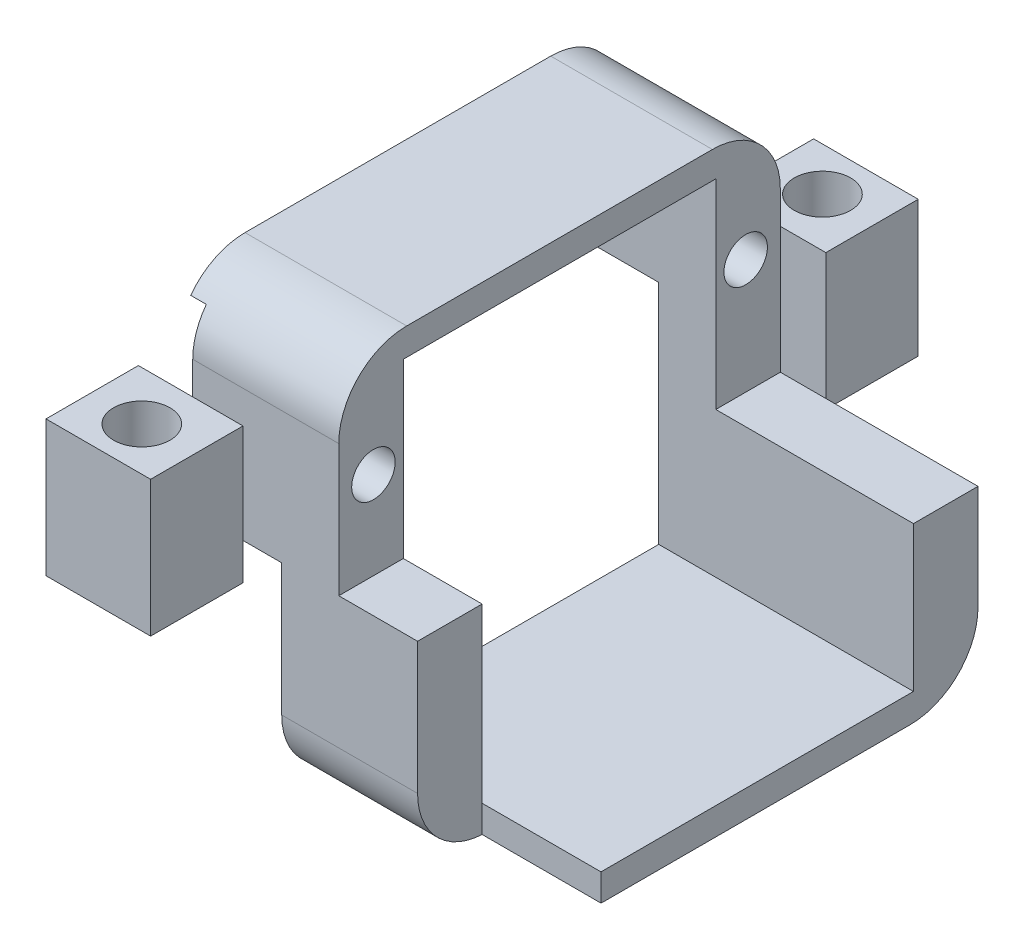
from build123d import *

# Parameters (mm, degrees)
BOSS_EXTRUDE1_DEPTH = 2
SKETCH1_3_W         = 10
SKETCH1_3_H         = 4.75
BOSS_EXTRUDE2_DEPTH = 12.7
BOSS_EXTRUDE3_START = 12.7
SKETCH3_W           = 11.9
SKETCH3_H           = 4.75
SKETCH3_W_2         = 10.75
BOSS_EXTRUDE3_DEPTH = 12.7
BOSS_EXTRUDE4_START = 25.4
SKETCH3_3_W         = 11.9
SKETCH3_3_H         = 4.75
SKETCH3_3_W_2       = 10.75
SKETCH3_3_W_3       = 1.15
BOSS_EXTRUDE4_DEPTH = 2
CUT_EXTRUDE1_START  = -1.1
SKETCH2_R           = 1.6
CUT_EXTRUDE1_DEPTH  = 8
CUT_EXTRUDE2_START  = 3.1
SKETCH2_3_R         = 1.6
CUT_EXTRUDE2_DEPTH  = 8
BOSS_EXTRUDE5_START = 10
SKETCH1_4_R         = 2.075
BOSS_EXTRUDE5_DEPTH = 10
FILLET1_R           = 5
CUT_EXTRUDE3_START  = 12.7
SKETCH5_W           = 14.55
SKETCH5_H           = 4.75
CUT_EXTRUDE3_DEPTH  = 2
CUT_EXTRUDE4_START  = 12.7
SKETCH6_W           = 7.7
SKETCH6_H           = 4.75
CUT_EXTRUDE4_DEPTH  = 4


with BuildPart() as part:
    # Sketch1 → Boss-Extrude1 (new body)
    with BuildSketch(Plane(origin=(0, 0, 0), x_dir=(1, 0, 0), z_dir=(0, 1, 0))):
        Polygon((-1.1, 16.25), (-1.1, -16.25), (8.9, -16.25), (8.9, -11.5), (17.65, -11.5), (17.65, 16.25), align=None)
    extrude(amount=-BOSS_EXTRUDE1_DEPTH)

    # Sketch1<3> → Boss-Extrude2 (add)
    with BuildSketch(Plane(origin=(0, 0, 0), x_dir=(1, 0, 0), z_dir=(0, 1, 0))):
        Polygon((6.45, 16.25), (-1.1, 16.25), (-1.1, 11.5), (17.65, 11.5), (17.65, 16.25), align=None)
        with Locations((3.9, -13.875)):
            Rectangle(SKETCH1_3_W, SKETCH1_3_H)
    extrude(amount=BOSS_EXTRUDE2_DEPTH)

    # Sketch3 → Boss-Extrude3 (add)
    with BuildSketch(Plane(origin=(0, 0, 0), x_dir=(1, 0, 0), z_dir=(0, 1, 0)).offset(BOSS_EXTRUDE3_START)):
        with Locations((-2.85, 13.875)):
            Rectangle(SKETCH3_W, SKETCH3_H)
        with Locations((-2.275, -13.875)):
            Rectangle(SKETCH3_W_2, SKETCH3_H)
    extrude(amount=BOSS_EXTRUDE3_DEPTH)

    # Sketch3<3> → Boss-Extrude4 (add)
    with BuildSketch(Plane(origin=(0, 0, 0), x_dir=(1, 0, 0), z_dir=(0, 1, 0)).offset(BOSS_EXTRUDE4_START)):
        with Locations((-2.85, 13.875)):
            Rectangle(SKETCH3_3_W, SKETCH3_3_H)
        Polygon((3.1, -11.5), (3.1, 11.5), (-8.8, 11.5), (-8.8, -11.5), (-7.65, -11.5), align=None)
        with Locations((-2.275, -13.875)):
            Rectangle(SKETCH3_3_W_2, SKETCH3_3_H)
        with Locations((-8.225, -13.875)):
            Rectangle(SKETCH3_3_W_3, SKETCH3_3_H)
    extrude(amount=BOSS_EXTRUDE4_DEPTH)

    # Sketch2 → Cut-Extrude1 (cut)
    with BuildSketch(Plane(origin=(0, 0, 0), x_dir=(0, 0, -1), z_dir=(1, 0, 0)).offset(CUT_EXTRUDE1_START)):
        with Locations(Location((-13.7, 6.45, 0), (0, 0, 180))):
            Circle(SKETCH2_R)
        with Locations(Location((13.7, 6.45, 0), (0, 0, 180))):
            Circle(SKETCH2_R)
    extrude(amount=CUT_EXTRUDE1_DEPTH, mode=Mode.SUBTRACT)

    # Sketch2<3> → Cut-Extrude2 (cut)
    with BuildSketch(Plane(origin=(0, 0, 0), x_dir=(0, 0, -1), z_dir=(1, 0, 0)).offset(CUT_EXTRUDE2_START)):
        with Locations(Location((13.7, 19.15, 0), (0, 0, 180))):
            Circle(SKETCH2_3_R)
        with Locations(Location((-13.7, 19.15, 0), (0, 0, 180))):
            Circle(SKETCH2_3_R)
    extrude(amount=-CUT_EXTRUDE2_DEPTH, mode=Mode.SUBTRACT)

    # Sketch1<4> → Boss-Extrude5 (add)
    # profile 1 of 2: a face of its own
    with BuildSketch(Plane(origin=(0, 0, 0), x_dir=(1, 0, 0), z_dir=(0, 1, 0)).offset(BOSS_EXTRUDE5_START)):
        Polygon((-1.25, 16.25), (-1.1, 16.25), (6.45, 16.25), (6.45, 23.05), (-1.25, 23.05), align=None)
        with Locations(Location((2.6, 19.85, 0), (0, 0, 270))):
            Circle(SKETCH1_4_R, mode=Mode.SUBTRACT)
    # profile 2 of 2: a face of its own
    with BuildSketch(Plane(origin=(0, 0, 0), x_dir=(1, 0, 0), z_dir=(0, 1, 0)).offset(BOSS_EXTRUDE5_START)):
        Polygon((-3.95, -23.05), (-3.95, -16.25), (-8.8, -16.25), (-11.65, -16.25), (-11.65, -23.05), align=None)
        with Locations(Location((-7.8, -19.85, 0), (0, 0, 270))):
            Circle(SKETCH1_4_R, mode=Mode.SUBTRACT)
    extrude(amount=BOSS_EXTRUDE5_DEPTH)

    # Fillet1
    fillet1_edges = [part.edges().sort_by_distance(p)[0] for p in [
        (3.9, -2, 16.25),
        (-2.85, 27.4, 16.25),
        (8.275, -2, -16.25),
        (-2.85, 27.4, -16.25),
    ]]
    fillet(fillet1_edges, radius=FILLET1_R)

    # Sketch5 → Cut-Extrude3 (cut)
    with BuildSketch(Plane(origin=(0, 0, 0), x_dir=(1, 0, 0), z_dir=(0, 1, 0)).offset(CUT_EXTRUDE3_START)):
        with Locations((10.375, 13.875)):
            Rectangle(SKETCH5_W, SKETCH5_H)
    extrude(amount=-CUT_EXTRUDE3_DEPTH, mode=Mode.SUBTRACT)

    # Sketch6 → Cut-Extrude4 (cut)
    with BuildSketch(Plane(origin=(0, 0, 0), x_dir=(1, 0, 0), z_dir=(0, 1, 0)).offset(CUT_EXTRUDE4_START)):
        with Locations((-4.95, 13.875)):
            Rectangle(SKETCH6_W, SKETCH6_H)
    extrude(amount=CUT_EXTRUDE4_DEPTH, mode=Mode.SUBTRACT)


solid = part.part
